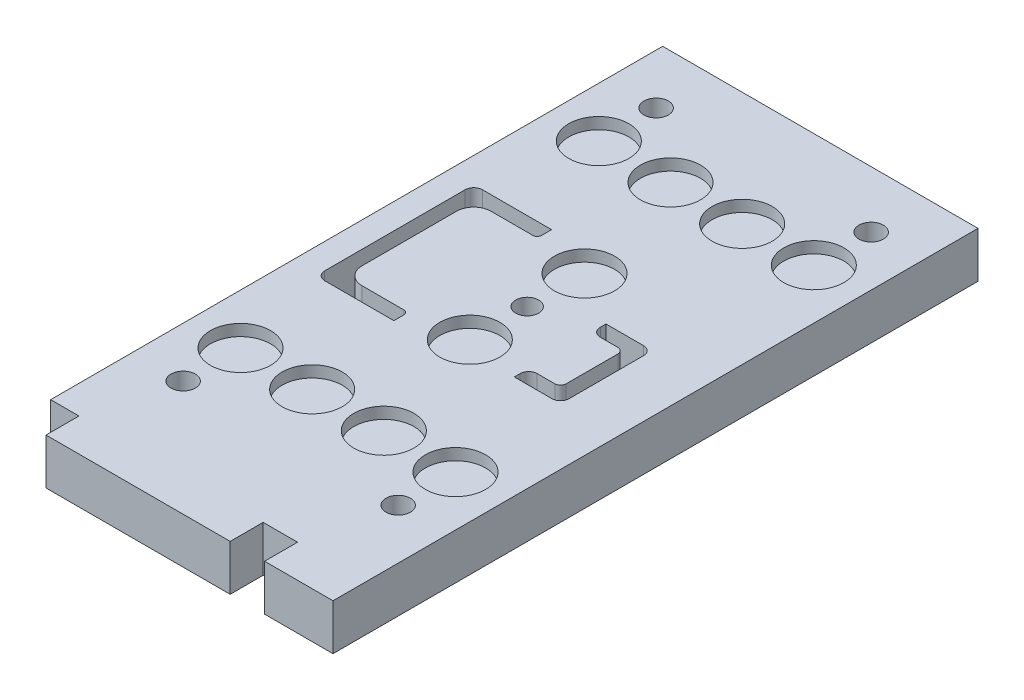
from build123d import *

# Parameters (mm, degrees)
SKETCH1_W           = 110
SKETCH1_H           = 225
BOSS_EXTRUDE1_DEPTH = 16
CUT_EXTRUDE1_REACH  = 128.243
CUT_EXTRUDE2_REACH  = 128.243
SKETCH4_R           = 8.5
CUT_EXTRUDE3_DEPTH  = 5
SKETCH5_R           = 10.5
CUT_EXTRUDE4_DEPTH  = 4
CUT_EXTRUDE5_REACH  = 128.243
SKETCH6_W           = 12
SKETCH6_H           = 11.5
M10_TAPPED_HOLE1_D  = 8.5
CUT_EXTRUDE6_REACH  = 128.243
SKETCH10_R          = 4


with BuildPart() as part:
    # Sketch1 → Boss-Extrude1 (new body)
    with BuildSketch(Plane(origin=(0, 0, 0), x_dir=(1, 0, 0), z_dir=(0, 1, 0))):
        Rectangle(SKETCH1_W, SKETCH1_H)
    extrude(amount=-BOSS_EXTRUDE1_DEPTH)

    # Sketch2 → Cut-Extrude1 (cut, up to next)
    with BuildSketch(Plane(origin=(0, 0, 0), x_dir=(1, 0, 0), z_dir=(0, 1, 0)), mode=Mode.PRIVATE) as cut_extrude1_sk1:
        with BuildLine():
            Line((-19, 37.73), (-19, 34.23))
            ThreePointArc((-19, 34.23), (-19.439339828, 33.169339828), (-20.5, 32.73))
            Line((-20.5, 32.73), (-35.12, 32.73))
            ThreePointArc((-35.12, 32.73), (-39.362640687, 30.972640687), (-41.12, 26.73))
            Line((-41.12, 26.73), (-41.12, -6.27))
            ThreePointArc((-41.12, -6.27), (-39.362640687, -10.512640687), (-35.12, -12.27))
            Line((-35.12, -12.27), (-20.5, -12.27))
            ThreePointArc((-20.5, -12.27), (-19.439339828, -12.709339828), (-19, -13.77))
            Line((-19, -13.77), (-19, -17.27))
            Line((-19, -17.27), (-43.12, -17.27))
            ThreePointArc((-43.12, -17.27), (-45.241320344, -16.391320344), (-46.12, -14.27))
            Line((-46.12, -14.27), (-46.12, 34.73))
            ThreePointArc((-46.12, 34.73), (-45.241320344, 36.851320344), (-43.12, 37.73))
            Line((-43.12, 37.73), (-19, 37.73))
        make_face()
    cut_extrude1_tool1 = extrude(cut_extrude1_sk1.sketch, amount=-CUT_EXTRUDE1_REACH, mode=Mode.PRIVATE) & part.part
    add(cut_extrude1_tool1.solids().sort_by_distance((-44.807702, 0, 15.957702))[0], mode=Mode.SUBTRACT)

    # Sketch3 → Cut-Extrude2 (cut, up to next)
    with BuildSketch(Plane(origin=(0, 0, 0), x_dir=(1, 0, 0), z_dir=(0, 1, 0)), mode=Mode.PRIVATE) as cut_extrude2_sk1:
        with BuildLine():
            Line((19, 18.73), (32.13, 18.73))
            ThreePointArc((32.13, 18.73), (34.251320344, 17.851320344), (35.13, 15.73))
            Line((35.13, 15.73), (35.13, -10.27))
            ThreePointArc((35.13, -10.27), (34.251320344, -12.391320344), (32.13, -13.27))
            Line((32.13, -13.27), (19, -13.27))
            Line((19, -13.27), (19, -11.27))
            ThreePointArc((19, -11.27), (19.878679656, -9.148679656), (22, -8.27))
            Line((22, -8.27), (28.13, -8.27))
            ThreePointArc((28.13, -8.27), (29.544213562, -7.684213562), (30.13, -6.27))
            Line((30.13, -6.27), (30.13, 11.73))
            ThreePointArc((30.13, 11.73), (29.544213562, 13.144213562), (28.13, 13.73))
            Line((28.13, 13.73), (22, 13.73))
            ThreePointArc((22, 13.73), (19.878679656, 14.608679656), (19, 16.73))
            Line((19, 16.73), (19, 18.73))
        make_face()
    cut_extrude2_tool1 = extrude(cut_extrude2_sk1.sketch, amount=-CUT_EXTRUDE2_REACH, mode=Mode.PRIVATE) & part.part
    add(cut_extrude2_tool1.solids().sort_by_distance((29.797608, 0, -13.397608))[0], mode=Mode.SUBTRACT)

    # Sketch4 → Cut-Extrude3 (cut)
    with BuildSketch(Plane.XZ.offset(16)):
        with Locations(Location((0, 100, 0), (0, 0, 270))):
            Circle(SKETCH4_R)
        with Locations(Location((0, -100, 0), (0, 0, 270))):
            Circle(SKETCH4_R)
    extrude(amount=-CUT_EXTRUDE3_DEPTH, mode=Mode.SUBTRACT)

    # Sketch5 → Cut-Extrude4 (cut)
    with BuildSketch(Plane(origin=(0, 0, 0), x_dir=(1, 0, 0), z_dir=(0, 1, 0))):
        with Locations(Location((-37.5, 72.73, 0), (0, 0, 270))):
            Circle(SKETCH5_R)
        with Locations(Location((-12.5, 72.73, 0), (0, 0, 270))):
            Circle(SKETCH5_R)
        with Locations(Location((12.5, 72.73, 0), (0, 0, 270))):
            Circle(SKETCH5_R)
        with Locations(Location((37.5, 72.73, 0), (0, 0, 270))):
            Circle(SKETCH5_R)
        with Locations(Location((37.5, -52.27, 0), (0, 0, 90))):
            Circle(SKETCH5_R)
        with Locations(Location((12.5, -52.27, 0), (0, 0, 90))):
            Circle(SKETCH5_R)
        with Locations(Location((-12.5, -52.27, 0), (0, 0, 90))):
            Circle(SKETCH5_R)
        with Locations(Location((-37.5, -52.27, 0), (0, 0, 90))):
            Circle(SKETCH5_R)
        with Locations(Location((0, 30.23, 0), (0, 0, 270))):
            Circle(SKETCH5_R)
        with Locations(Location((0, -9.77, 0), (0, 0, 270))):
            Circle(SKETCH5_R)
    extrude(amount=-CUT_EXTRUDE4_DEPTH, mode=Mode.SUBTRACT)

    # Sketch6 → Cut-Extrude5 (cut, up to next)
    with BuildSketch(Plane(origin=(0, 0, 0), x_dir=(1, 0, 0), z_dir=(0, 1, 0)), mode=Mode.PRIVATE) as cut_extrude5_sk1:
        with Locations((25.13, -106.75)):
            Rectangle(SKETCH6_W, SKETCH6_H)
    cut_extrude5_tool1 = extrude(cut_extrude5_sk1.sketch, amount=-CUT_EXTRUDE5_REACH, mode=Mode.PRIVATE) & part.part
    # Sketch6 → Cut-Extrude5 (cut, up to next)
    with BuildSketch(Plane(origin=(0, 0, 0), x_dir=(1, 0, 0), z_dir=(0, 1, 0)), mode=Mode.PRIVATE) as cut_extrude5_sk2:
        with Locations((-51.12, -106.75)):
            Rectangle(SKETCH6_W, SKETCH6_H)
    cut_extrude5_tool2 = extrude(cut_extrude5_sk2.sketch, amount=-CUT_EXTRUDE5_REACH, mode=Mode.PRIVATE) & part.part
    add(cut_extrude5_tool1.solids().sort_by_distance((25.13, 0, 106.75))[0], mode=Mode.SUBTRACT)
    add(cut_extrude5_tool2.solids().sort_by_distance((-51.12, 0, 106.75))[0], mode=Mode.SUBTRACT)

    # M10 Tapped Hole1 (through all)
    with Locations(Plane(origin=(0, 0, 0), x_dir=(1, 0, 0), z_dir=(0, 1, 0))):
        with Locations((-37.5, -72.27), (37.5, -72.27), (37.5, 92.73), (-37.5, 92.73)):
            Hole(M10_TAPPED_HOLE1_D / 2)

    # Sketch10 → Cut-Extrude6 (cut, up to next)
    with BuildSketch(Plane(origin=(0, 0, 0), x_dir=(1, 0, 0), z_dir=(0, 1, 0)), mode=Mode.PRIVATE) as cut_extrude6_sk1:
        with Locations(Location((0, 10.23, 0), (0, 0, 270))):
            Circle(SKETCH10_R)
    cut_extrude6_tool1 = extrude(cut_extrude6_sk1.sketch, amount=-CUT_EXTRUDE6_REACH, mode=Mode.PRIVATE) & part.part
    add(cut_extrude6_tool1.solids().sort_by_distance((0, 0, -10.23))[0], mode=Mode.SUBTRACT)


solid = part.part
